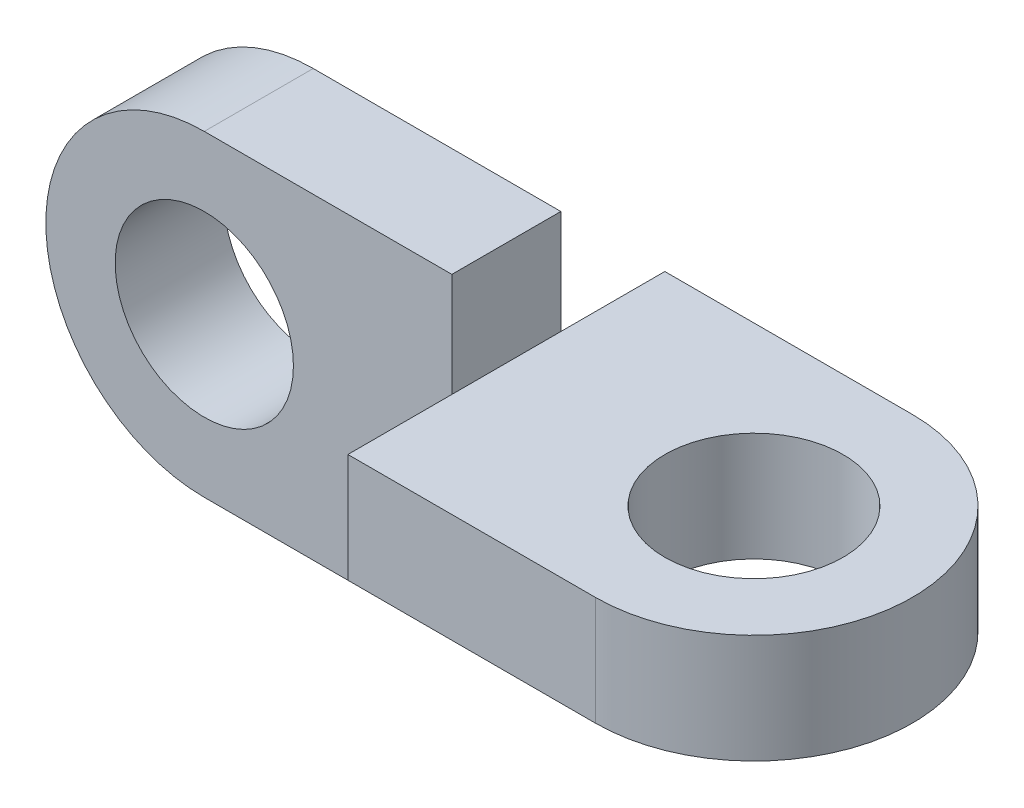
from build123d import *

# Parameters (mm, degrees)
SKETCH1_R           = 18
BOSS_EXTRUDE1_DEPTH = 11
SKETCH2_R           = 18
BOSS_EXTRUDE2_DEPTH = 11


with BuildPart() as part:
    # Sketch1 → Boss-Extrude1 (new, symmetric)
    with BuildSketch(Plane.XY):
        with BuildLine():
            Line((0, 32), (50, 32))
            Line((50, 32), (50, -32))
            Line((50, -32), (0, -32))
            ThreePointArc((0, -32), (-32, 0), (0, 32))
        make_face()
        Circle(SKETCH1_R, mode=Mode.SUBTRACT)
    extrude(amount=BOSS_EXTRUDE1_DEPTH, both=True)

    # Sketch2 → Boss-Extrude2 (add, symmetric)
    with BuildSketch(Plane(origin=(100, 0, 0), x_dir=(-1, 0, 0), z_dir=(0, 1, 0))):
        with BuildLine():
            Line((0, 32), (50, 32))
            Line((50, 32), (50, -32))
            Line((50, -32), (0, -32))
            ThreePointArc((0, -32), (-32, 0), (0, 32))
        make_face()
        with Locations(Location((0, 0, 0), (0, 0, 90))):
            Circle(SKETCH2_R, mode=Mode.SUBTRACT)
    extrude(amount=BOSS_EXTRUDE2_DEPTH, both=True)


solid = part.part
